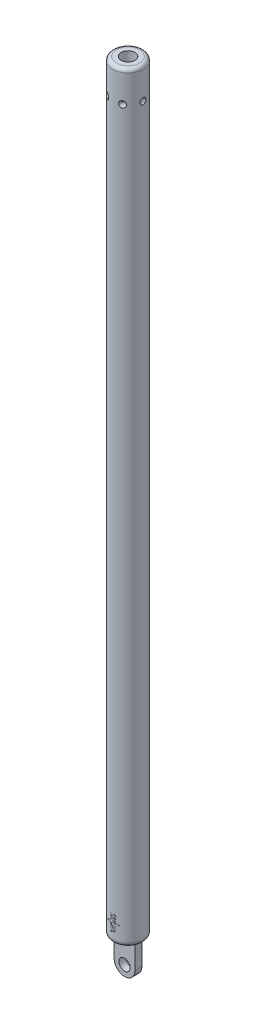
from build123d import *

# Parameters (mm, degrees)
PATTERN_MARK_COUNT  = 6
SKETCH13_R          = 4.05
CLEVIS_DEPTH        = 5
CUT_LOGO_REACH      = 550.791
CUT_LOGO_END_RADIUS = 10.9
SKETCH17_W          = 1.391860444
SKETCH17_H          = 0.646227812


with BuildPart() as part:
    # Sketch5 → Body (revolve)
    with BuildSketch(Plane.XY, mode=Mode.PRIVATE) as body_sk:
        with BuildLine():
            Line((-5, 550.574702185), (-5, 50.574702185))
            Line((-5, 50.574702185), (0, 50.574702185))
            Line((0, 50.574702185), (0, -2.425297815))
            Line((0, -2.425297815), (-9.051334669, 0))
            ThreePointArc((-9.051334669, 0), (-10.456697883, 0.939033678), (-11, 2.539550102))
            Line((-11, 2.539550102), (-11, 547.945566455))
            ThreePointArc((-11, 547.945566455), (-10.229943973, 549.804646158), (-8.37086427, 550.574702185))
            Line((-8.37086427, 550.574702185), (-5, 550.574702185))
        make_face()
    revolve(body_sk.sketch.rotate(Axis((0, -24.925297815, 0), (0, 1, 0)), 180), axis=Axis((0, -24.925297815, 0), (0, 1, 0)))

    # Sketch11 → Cut-Mark (revolve, cut)
    with BuildSketch(Plane.XY):
        with BuildLine():
            Line((11, 527.988035521), (11, 530.276817743))
            ThreePointArc((11, 530.276817743), (10.129727641, 529.276417267), (9.816282959, 527.988035521))
            Line((9.816282959, 527.988035521), (11, 527.988035521))
        make_face()
    cut_mark = revolve(axis=Axis((9.816282959, 527.988035521, 0), (1, 0, 0)), mode=Mode.SUBTRACT)

    # Pattern-Mark: Cut-Mark ×6 about axis
    pattern_mark_axis = Axis((0, 0, 0), (0, 1, 0))
    for i in range(1, PATTERN_MARK_COUNT):
        add(cut_mark.rotate(pattern_mark_axis, i * 360 / PATTERN_MARK_COUNT), mode=Mode.SUBTRACT)

    # Sketch13 → Clevis (add)
    with BuildSketch(Plane.XY.offset(-2.5)):
        with BuildLine():
            Line((7.5, 1.731511433), (7.5, -17.425297815))
            ThreePointArc((7.5, -17.425297815), (0, -24.925297815), (-7.5, -17.425297815))
            Line((-7.5, -17.425297815), (-7.5, 1.731511433))
            Line((-7.5, 1.731511433), (7.5, 1.731511433))
        make_face()
        with Locations((0, -17.425297815)):
            Circle(SKETCH13_R, mode=Mode.SUBTRACT)
    extrude(amount=CLEVIS_DEPTH)

    # Cut-Logo: up to this cylinder (the profile starts outside it)
    cut_logo_end = Plane(origin=(0, 12.802125, 0), z_dir=(0, -1, 0)) * Cylinder(CUT_LOGO_END_RADIUS, 1134.730924, mode=Mode.PRIVATE)
    # Sketch17 → Cut-Logo (cut, up to the surface)
    with BuildSketch(Plane(origin=(-0.671842742, 2.901139113, 22), x_dir=(1, 0, 0), z_dir=(0, 0, 1)), mode=Mode.PRIVATE) as cut_logo_sk1:
        with BuildLine():
            Line((0.789960689, 9.623304428), (1.411288187, 10.228663732))
            ThreePointArc((1.411288187, 10.228663732), (1.65288163, 10.370964092), (1.932887587, 10.385573947))
            ThreePointArc((1.932887587, 10.385573947), (2.648141292, 10.138952195), (3.263813904, 9.69922798))
            Line((3.263813904, 9.69922798), (3.267258216, 10.445028383))
            ThreePointArc((3.267258216, 10.445028383), (2.693273438, 10.77154972), (2.064892552, 10.974557531))
            ThreePointArc((2.064892552, 10.974557531), (1.49990164, 10.954887701), (1.007400649, 10.677318959))
            Line((1.007400649, 10.677318959), (1.00517246, 10.675233067))
            Line((1.00517246, 10.675233067), (0.393220916, 10.099417545))
            ThreePointArc((0.393220916, 10.099417545), (-0.224389248, 9.783975871), (-0.914872512, 9.848618125))
            ThreePointArc((-0.914872512, 9.848618125), (-1.396113072, 10.108134918), (-1.803012952, 10.473338876))
            Line((-1.803012952, 10.473338876), (-1.806456971, 9.727605032))
            ThreePointArc((-1.806456971, 9.727605032), (-0.530683116, 9.116967392), (0.789960689, 9.623304428))
        make_face()
    cut_logo_tool1 = extrude(cut_logo_sk1.sketch, amount=-CUT_LOGO_REACH, mode=Mode.PRIVATE) - cut_logo_end
    add(cut_logo_tool1.solids().sort_by_distance((0.02915, 12.939595, 22))[0], mode=Mode.SUBTRACT)
    # Sketch17 → Cut-Logo (cut, up to the surface)
    with BuildSketch(Plane(origin=(-0.671842742, 2.901139113, 22), x_dir=(1, 0, 0), z_dir=(0, 0, 1)), mode=Mode.PRIVATE) as cut_logo_sk2:
        with Locations((4.307915478, 10.066047429)):
            Rectangle(SKETCH17_W, SKETCH17_H)
    cut_logo_tool2 = extrude(cut_logo_sk2.sketch, amount=-CUT_LOGO_REACH, mode=Mode.PRIVATE) - cut_logo_end
    add(cut_logo_tool2.solids().sort_by_distance((3.636073, 12.967187, 22))[0], mode=Mode.SUBTRACT)
    # Sketch17 → Cut-Logo (cut, up to the surface)
    with BuildSketch(Plane(origin=(-0.671842742, 2.901139113, 22), x_dir=(1, 0, 0), z_dir=(0, 0, 1)), mode=Mode.PRIVATE) as cut_logo_sk3:
        with Locations((-2.850147613, 10.099105336)):
            Rectangle(SKETCH17_W, SKETCH17_H)
    cut_logo_tool3 = extrude(cut_logo_sk3.sketch, amount=-CUT_LOGO_REACH, mode=Mode.PRIVATE) - cut_logo_end
    add(cut_logo_tool3.solids().sort_by_distance((-3.52199, 13.000244, 22))[0], mode=Mode.SUBTRACT)
    # Sketch17 → Cut-Logo (cut, up to the surface)
    with BuildSketch(Plane(origin=(-0.671842742, 2.901139113, 22), x_dir=(1, 0, 0), z_dir=(0, 0, 1)), mode=Mode.PRIVATE) as cut_logo_sk4:
        with BuildLine():
            Line((2.693032119, 13.588420593), (-0.200208507, 13.588420593))
            ThreePointArc((-0.200208507, 13.588420593), (-1.293813141, 12.494815959), (-0.200208507, 11.401211324))
            Line((-0.200208507, 11.401211324), (2.682930984, 11.401211324))
            Line((2.682930984, 11.401211324), (2.682930984, 11.89830434))
            Line((2.682930984, 11.89830434), (-0.244376798, 11.89830434))
            ThreePointArc((-0.244376798, 11.89830434), (-0.840888417, 12.494815959), (-0.244376798, 13.091327578))
            Line((-0.244376798, 13.091327578), (2.690736407, 13.091327578))
            Line((2.690736407, 13.091327578), (2.693032119, 13.588420593))
        make_face()
    cut_logo_tool4 = extrude(cut_logo_sk4.sketch, amount=-CUT_LOGO_REACH, mode=Mode.PRIVATE) - cut_logo_end
    add(cut_logo_tool4.solids().sort_by_distance((0.551337, 16.037941, 22))[0], mode=Mode.SUBTRACT)
    # Sketch17 → Cut-Logo (cut, up to the surface)
    with BuildSketch(Plane(origin=(-0.671842742, 2.901139113, 22), x_dir=(1, 0, 0), z_dir=(0, 0, 1)), mode=Mode.PRIVATE) as cut_logo_sk5:
        with BuildLine():
            Line((0.916317664, 15.68515501), (0.228677702, 14.810438125))
            ThreePointArc((0.228677702, 14.810438125), (-0.510472569, 14.647287855), (-0.814544654, 15.340469867))
            ThreePointArc((-0.814544654, 15.340469867), (-0.662181765, 15.726963687), (-0.434978766, 16.074772141))
            Line((-0.434978766, 16.074772141), (-1.081192795, 16.077756535))
            ThreePointArc((-1.081192795, 16.077756535), (-1.21488126, 15.650817468), (-1.281524579, 15.208428226))
            ThreePointArc((-1.281524579, 15.208428226), (-0.585636237, 14.10931802), (0.668951588, 14.453284906))
            Line((0.668951588, 14.453284906), (1.35659155, 15.328001791))
            ThreePointArc((1.35659155, 15.328001791), (1.89243285, 15.496247684), (2.243117708, 15.057553361))
            ThreePointArc((2.243117708, 15.057553361), (2.207838577, 14.625052607), (2.041965762, 14.224069156))
            Line((2.041965762, 14.224069156), (2.588762248, 14.2215439))
            ThreePointArc((2.588762248, 14.2215439), (2.664337294, 14.638954132), (2.692056888, 15.062244237))
            ThreePointArc((2.692056888, 15.062244237), (2.026996605, 16.008864857), (0.916317664, 15.68515501))
        make_face()
    cut_logo_tool5 = extrude(cut_logo_sk5.sketch, amount=-CUT_LOGO_REACH, mode=Mode.PRIVATE) - cut_logo_end
    add(cut_logo_tool5.solids().sort_by_distance((-0.005716, 17.976587, 22))[0], mode=Mode.SUBTRACT)
    # Sketch17 → Cut-Logo (cut, up to the surface)
    with BuildSketch(Plane(origin=(-0.671842742, 2.901139113, 22), x_dir=(1, 0, 0), z_dir=(0, 0, 1)), mode=Mode.PRIVATE) as cut_logo_sk6:
        with BuildLine():
            Line((-1.316529321, 8.672073163), (-1.316529321, 8.174980147))
            Line((-1.316529321, 8.174980147), (0.373586933, 8.174980147))
            Line((0.373586933, 8.174980147), (0.373586933, 7.727596433))
            ThreePointArc((0.373586933, 7.727596433), (0.523477648, 7.231847067), (0.922930653, 6.902192767))
            ThreePointArc((0.922930653, 6.902192767), (1.516900869, 6.782918937), (2.110871084, 6.902192767))
            ThreePointArc((2.110871084, 6.902192767), (2.510324089, 7.231847067), (2.660214805, 7.727596433))
            Line((2.660214805, 7.727596433), (2.660214805, 8.672073163))
            Line((2.660214805, 8.672073163), (-1.316529321, 8.672073163))
        make_face()
        with BuildLine():
            Line((0.820947852, 8.165108689), (2.163113308, 8.165108689))
            Line((2.163113308, 8.165108689), (2.161248131, 7.761240159))
            ThreePointArc((2.161248131, 7.761240159), (2.090196324, 7.521376383), (1.901475668, 7.357158527))
            ThreePointArc((1.901475668, 7.357158527), (1.487884029, 7.267251624), (1.075140443, 7.36097477))
            ThreePointArc((1.075140443, 7.36097477), (0.887944611, 7.526928713), (0.819111302, 7.767438517))
            Line((0.819111302, 7.767438517), (0.820947852, 8.165108689))
        make_face(mode=Mode.SUBTRACT)
    cut_logo_tool6 = extrude(cut_logo_sk6.sketch, amount=-CUT_LOGO_REACH, mode=Mode.PRIVATE) - cut_logo_end
    add(cut_logo_tool6.solids().sort_by_distance((1.944345, 11.100974, 22))[0], mode=Mode.SUBTRACT)
    # Sketch17 → Cut-Logo (cut, up to the surface)
    with BuildSketch(Plane(origin=(-0.671842742, 2.901139113, 22), x_dir=(1, 0, 0), z_dir=(0, 0, 1)), mode=Mode.PRIVATE) as cut_logo_sk7:
        Polygon((-0.287739269, 4.901807479), (-1.332828706, 4.645657373), (-1.335353963, 4.098860887), (2.646168699, 5.124379584), (2.649153094, 5.770593613), (-1.32249811, 6.882552089), (-1.325023367, 6.335755603), (-0.282417447, 6.054147181), align=None)
        Polygon((1.951738096, 5.450700561), (0.209922368, 5.023783719), (0.214061563, 5.920047932), align=None, mode=Mode.SUBTRACT)
    cut_logo_tool7 = extrude(cut_logo_sk7.sketch, amount=-CUT_LOGO_REACH, mode=Mode.PRIVATE) - cut_logo_end
    add(cut_logo_tool7.solids().sort_by_distance((-1.470556, 7.627663, 22))[0], mode=Mode.SUBTRACT)


solid = part.part
